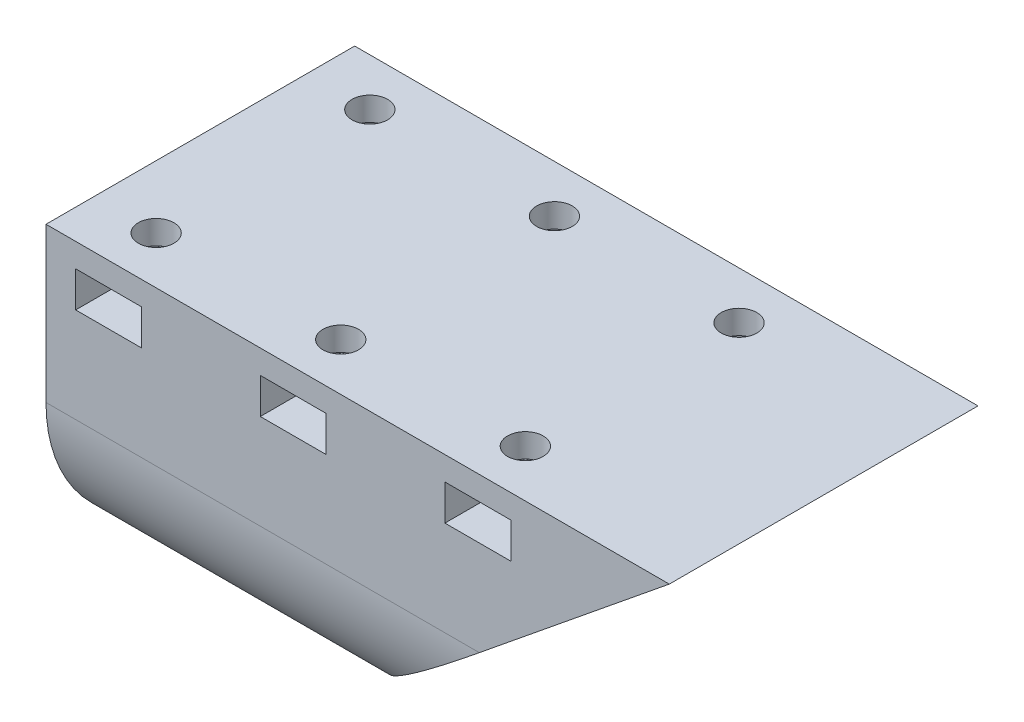
from build123d import *

# Parameters (mm, degrees)
SKETCH1_R                       = 13
SKETCH1_R_2                     = 1
BOSS_EXTRUDE1_DEPTH             = 2.5
SKETCH2_R                       = 11.25
BOSS_EXTRUDE2_DEPTH             = 50
BOSS_EXTRUDE2_DIRECTION_2_REACH = 20.554
CUT_EXTRUDE1_DEPTH              = 56.625983137
CUT_EXTRUDE1_DEPTH_BACK         = 56.625983137
SKETCH4_W                       = 5.55
SKETCH4_H                       = 3
CUT_EXTRUDE2_DEPTH              = 6.75
SKETCH5_R                       = 1.5
CUT_EXTRUDE3_DEPTH              = 5


with BuildPart() as part:
    # Sketch1 → Boss-Extrude1 (new body)
    with BuildSketch(Plane(origin=(0, 0, 0), x_dir=(0, 0, -1), z_dir=(1, 0, 0))):
        Circle(SKETCH1_R)
        with Locations((0, 9)):
            Circle(SKETCH1_R_2, mode=Mode.SUBTRACT)
        with Locations((9, 0)):
            Circle(SKETCH1_R_2, mode=Mode.SUBTRACT)
        with Locations((0, -9)):
            Circle(SKETCH1_R_2, mode=Mode.SUBTRACT)
        with Locations((-9, 0)):
            Circle(SKETCH1_R_2, mode=Mode.SUBTRACT)
        with BuildLine():
            Line((1.491573557, 6.993707817), (6.993707817, 1.491573557))
            ThreePointArc((6.993707817, 1.491573557), (5.056517611, -5.056517611), (-1.491573557, -6.993707817))
            Line((-1.491573557, -6.993707817), (-6.993707817, -1.491573557))
            ThreePointArc((-6.993707817, -1.491573557), (-5.056517611, 5.056517611), (1.491573557, 6.993707817))
        make_face(mode=Mode.SUBTRACT)
    extrude(amount=BOSS_EXTRUDE1_DEPTH)

    # Sketch2 → Boss-Extrude2 (add)
    with BuildSketch(Plane(origin=(2.5, 0, 0), x_dir=(0, 0, -1), z_dir=(1, 0, 0))):
        with BuildLine():
            Line((-13, 13), (13, 13))
            Line((13, 13), (13, 0))
            ThreePointArc((13, 0), (0, -13), (-13, 0))
            Line((-13, 0), (-13, 13))
        make_face()
        Circle(SKETCH2_R, mode=Mode.SUBTRACT)
    extrude(amount=BOSS_EXTRUDE2_DEPTH)

    # Boss-Extrude2 direction 2: up to this face of the body (flat: up to its plane)
    boss_extrude2_direction_2_end = Plane(part.part.faces().sort_by_distance((0, 0, 12.632304474))[0])
    # Sketch2 → Boss-Extrude2 direction 2 (add, up to the picked face)
    with BuildSketch(Plane(origin=(2.5, 0, 0), x_dir=(0, 0, -1), z_dir=(1, 0, 0)), mode=Mode.PRIVATE) as boss_extrude2_direction_2_sk1:
        with BuildLine():
            Line((-13, 13), (13, 13))
            Line((13, 13), (13, 0))
            ThreePointArc((13, 0), (0, -13), (-13, 0))
            Line((-13, 0), (-13, 13))
        make_face()
        Circle(SKETCH2_R, mode=Mode.SUBTRACT)
    boss_extrude2_direction_2_tool1 = split(extrude(boss_extrude2_direction_2_sk1.sketch, amount=-BOSS_EXTRUDE2_DIRECTION_2_REACH, mode=Mode.PRIVATE), bisect_by=boss_extrude2_direction_2_end, keep=Keep.BOTH, mode=Mode.PRIVATE)
    add(boss_extrude2_direction_2_tool1.solids().sort_by(Axis((2.5, 6.5, 12.632304), (-1, 0, 0)))[0])

    # Sketch3 → Cut-Extrude1 (cut, two sides: drawn at the far end of the back side and taken through both)
    with BuildSketch(Plane.XY.offset(-CUT_EXTRUDE1_DEPTH_BACK)):
        Polygon((52.5, 13), (20.5, -13), (52.5, -13), align=None)
    extrude(amount=CUT_EXTRUDE1_DEPTH + CUT_EXTRUDE1_DEPTH_BACK, mode=Mode.SUBTRACT)

    # Sketch4 → Cut-Extrude2 (cut)
    with BuildSketch(Plane.XY.offset(13)):
        with Locations((5.275, 9.5)):
            Rectangle(SKETCH4_W, SKETCH4_H)
        with Locations((20.825, 9.5)):
            Rectangle(SKETCH4_W, SKETCH4_H)
        with Locations((36.375, 9.5)):
            Rectangle(SKETCH4_W, SKETCH4_H)
    cut_extrude2 = extrude(amount=-CUT_EXTRUDE2_DEPTH, mode=Mode.SUBTRACT)

    # Sketch5 → Cut-Extrude3 (cut)
    with BuildSketch(Plane(origin=(0, 13, 0), x_dir=(1, 0, 0), z_dir=(0, 1, 0))):
        with Locations(Location((5.275, -9, 0), (0, 0, 270))):
            Circle(SKETCH5_R)
        with Locations(Location((20.825, -9, 0), (0, 0, 270))):
            Circle(SKETCH5_R)
        with Locations(Location((36.375, -9, 0), (0, 0, 270))):
            Circle(SKETCH5_R)
    cut_extrude3 = extrude(amount=-CUT_EXTRUDE3_DEPTH, mode=Mode.SUBTRACT)

    # Mirror1: Cut-Extrude2, Cut-Extrude3 across plane
    add(cut_extrude2.mirror(Plane.XY), mode=Mode.SUBTRACT)
    add(cut_extrude3.mirror(Plane.XY), mode=Mode.SUBTRACT)


solid = part.part
